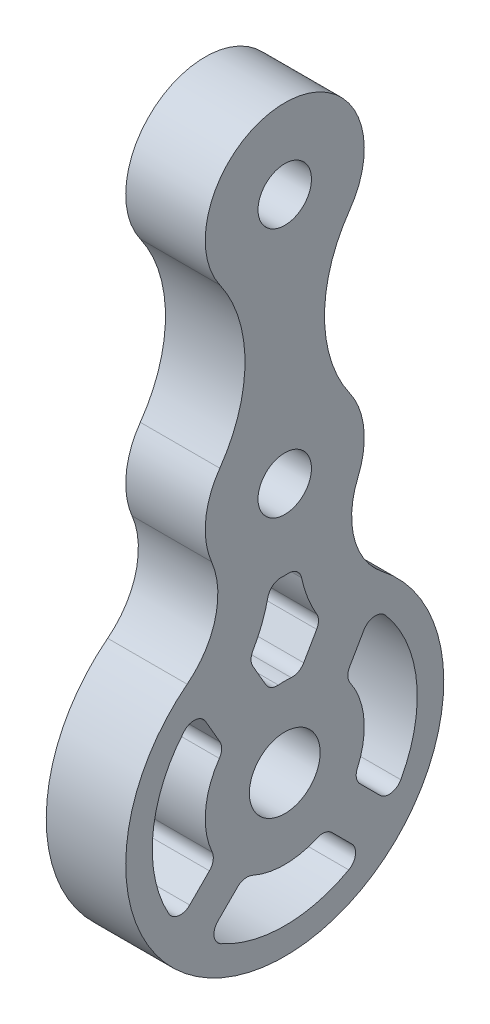
from build123d import *

# Parameters (mm, degrees)
SKETCH1_R           = 2.1209
SKETCH1_R_2         = 1.6002
BOSS_EXTRUDE1_DEPTH = 4.7625
CUT_EXTRUDE1_DEPTH  = 37.357096109
FILLET1_R           = 0.79375


with BuildPart() as part:
    # Sketch1 → Boss-Extrude1 (new body)
    with BuildSketch(Plane(origin=(0, 0, 0), x_dir=(0, 0, -1), z_dir=(1, 0, 0))):
        with BuildLine():
            ThreePointArc((-3.890248837, 27.252752244), (0, 34.7625), (3.890248837, 27.252752244))
            ThreePointArc((3.890248837, 27.252752244), (2.38125, 22.5), (3.890248837, 17.747247756))
            ThreePointArc((3.890248837, 17.747247756), (4.735348571, 15.507819022), (4.384317755, 13.140117187))
            ThreePointArc((4.384317755, 13.140117187), (4.159430641, 10.081636558), (5.845757006, 7.52015625))
            ThreePointArc((5.845757006, 7.52015625), (0, -9.525), (-5.845757006, 7.52015625))
            ThreePointArc((-5.845757006, 7.52015625), (-4.159430641, 10.081636558), (-4.384317755, 13.140117187))
            ThreePointArc((-4.384317755, 13.140117187), (-4.735348571, 15.507819022), (-3.890248837, 17.747247756))
            ThreePointArc((-3.890248837, 17.747247756), (-2.38125, 22.5), (-3.890248837, 27.252752244))
        make_face()
        with Locations(Location((0, 0, 0), (0, 0, 180))):
            Circle(SKETCH1_R, mode=Mode.SUBTRACT)
        with Locations(Location((0, 15, 0), (0, 0, 180))):
            Circle(SKETCH1_R_2, mode=Mode.SUBTRACT)
        with Locations(Location((0, 30, 0), (0, 0, 180))):
            Circle(SKETCH1_R_2, mode=Mode.SUBTRACT)
    extrude(amount=BOSS_EXTRUDE1_DEPTH)

    # Sketch2 → Cut-Extrude1 (cut, through all)
    with BuildSketch(Plane(origin=(4.7625, 0, 0), x_dir=(0, 0, -1), z_dir=(1, 0, 0))):
        with BuildLine():
            Line((-6.391057432, -4.707259409), (-4.102559861, -2.418761839))
            ThreePointArc((-4.102559861, -2.418761839), (-4.744354453, 0.41533971), (-3.619879359, 3.094814967))
            Line((-3.619879359, 3.094814967), (-5.263380295, 5.941442091))
            ThreePointArc((-5.263380295, 5.941442091), (-7.893363706, 0.835892131), (-6.391057432, -4.707259409))
        make_face()
        with BuildLine():
            Line((-2.418761839, -4.102559861), (-4.707259409, -6.391057432))
            ThreePointArc((-4.707259409, -6.391057432), (0, -7.9375), (4.707259409, -6.391057432))
            Line((4.707259409, -6.391057432), (2.418761839, -4.102559861))
            ThreePointArc((2.418761839, -4.102559861), (0, -4.7625), (-2.418761839, -4.102559861))
        make_face()
        with BuildLine():
            Line((-2.149945089, 6.898814128), (-0.870248702, 4.682314967))
            ThreePointArc((-0.870248702, 4.682314967), (0, 4.7625), (0.870248702, 4.682314967))
            Line((0.870248702, 4.682314967), (2.149945089, 6.898814128))
            ThreePointArc((2.149945089, 6.898814128), (1.320371493, 8.536647417), (0.889277805, 10.32126179))
            ThreePointArc((0.889277805, 10.32126179), (0, 10.2375), (-0.889277805, 10.32126179))
            ThreePointArc((-0.889277805, 10.32126179), (-1.320371493, 8.536647417), (-2.149945089, 6.898814128))
        make_face()
        with BuildLine():
            Line((6.391057432, -4.707259409), (4.102559861, -2.418761839))
            ThreePointArc((4.102559861, -2.418761839), (4.744354453, 0.41533971), (3.619879359, 3.094814967))
            Line((3.619879359, 3.094814967), (5.263380295, 5.941442091))
            ThreePointArc((5.263380295, 5.941442091), (7.893363706, 0.835892131), (6.391057432, -4.707259409))
        make_face()
    extrude(amount=-CUT_EXTRUDE1_DEPTH, mode=Mode.SUBTRACT)

    # Fillet1
    fillet1_edges = [part.edges().sort_by_distance(p)[0] for p in [
        (2.38125, -4.102559861, 2.418761839),
        (2.38125, -4.102559861, -2.418761839),
        (2.38125, -6.391057432, -4.707259409),
        (2.38125, -6.391057432, 4.707259409),
        (2.38125, 4.682314967, -0.870248702),
        (2.38125, 4.682314967, 0.870248702),
        (2.38125, 6.898814128, 2.149945089),
        (2.38125, 10.32126179, 0.889277805),
        (2.38125, 10.32126179, -0.889277805),
        (2.38125, 6.898814128, -2.149945089),
        (2.38125, 5.941442091, -5.263380295),
        (2.38125, -4.707259409, -6.391057432),
        (2.38125, -2.418761839, -4.102559861),
        (2.38125, 3.094814967, -3.619879359),
        (2.38125, -4.707259409, 6.391057432),
        (2.38125, 5.941442091, 5.263380295),
        (2.38125, 3.094814967, 3.619879359),
        (2.38125, -2.418761839, 4.102559861),
    ]]
    fillet(fillet1_edges, radius=FILLET1_R)


solid = part.part
